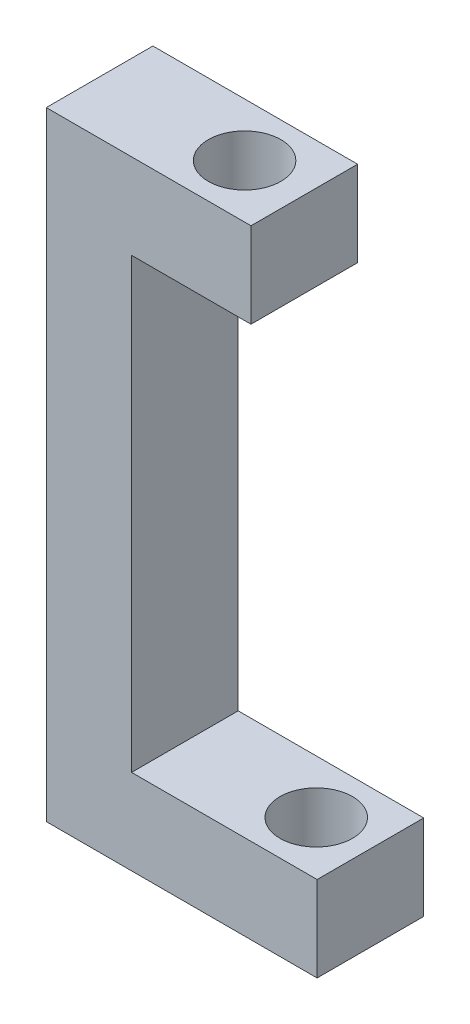
from build123d import *

# Parameters (mm, degrees)
RESSALTO_EXTRUS_O1_DEPTH    = 5
FURO_COM_FOLGA_DE_M32_D     = 3.4
FURO_COM_FOLGA_DE_M32_DEPTH = 4
FURO_COM_FOLGA_DE_M31_D     = 3.4
FURO_COM_FOLGA_DE_M31_DEPTH = 11.25
FURO_COM_FOLGA_DE_M31_TIP   = 1.021463052


with BuildPart() as part:
    # Esboço1 → Ressalto-extrusão1 (new body)
    with BuildSketch(Plane.XY):
        Polygon((12.7, -29), (0, -29), (0, 0), (9.6, 0), (9.6, -4), (4, -4), (4, -25), (12.7, -25), align=None)
    extrude(amount=RESSALTO_EXTRUS_O1_DEPTH)

    # Furo com folga de M32
    with Locations(Plane(origin=(0, -25, 0), x_dir=(1, 0, 0), z_dir=(0, 1, 0))):
        with Locations((10.16, -2.5)):
            Hole(FURO_COM_FOLGA_DE_M32_D / 2, depth=FURO_COM_FOLGA_DE_M32_DEPTH)

    # Furo com folga de M31
    with Locations(Plane(origin=(0, 0, 0), x_dir=(1, 0, 0), z_dir=(0, 1, 0))):
        with Locations((6.8, -2.5)):
            Hole(FURO_COM_FOLGA_DE_M31_D / 2, depth=FURO_COM_FOLGA_DE_M31_DEPTH)
            with Locations((0, 0, -(FURO_COM_FOLGA_DE_M31_DEPTH + FURO_COM_FOLGA_DE_M31_TIP / 2))):  # 118° drill point
                Cone(0, FURO_COM_FOLGA_DE_M31_D / 2, FURO_COM_FOLGA_DE_M31_TIP, mode=Mode.SUBTRACT)


solid = part.part
